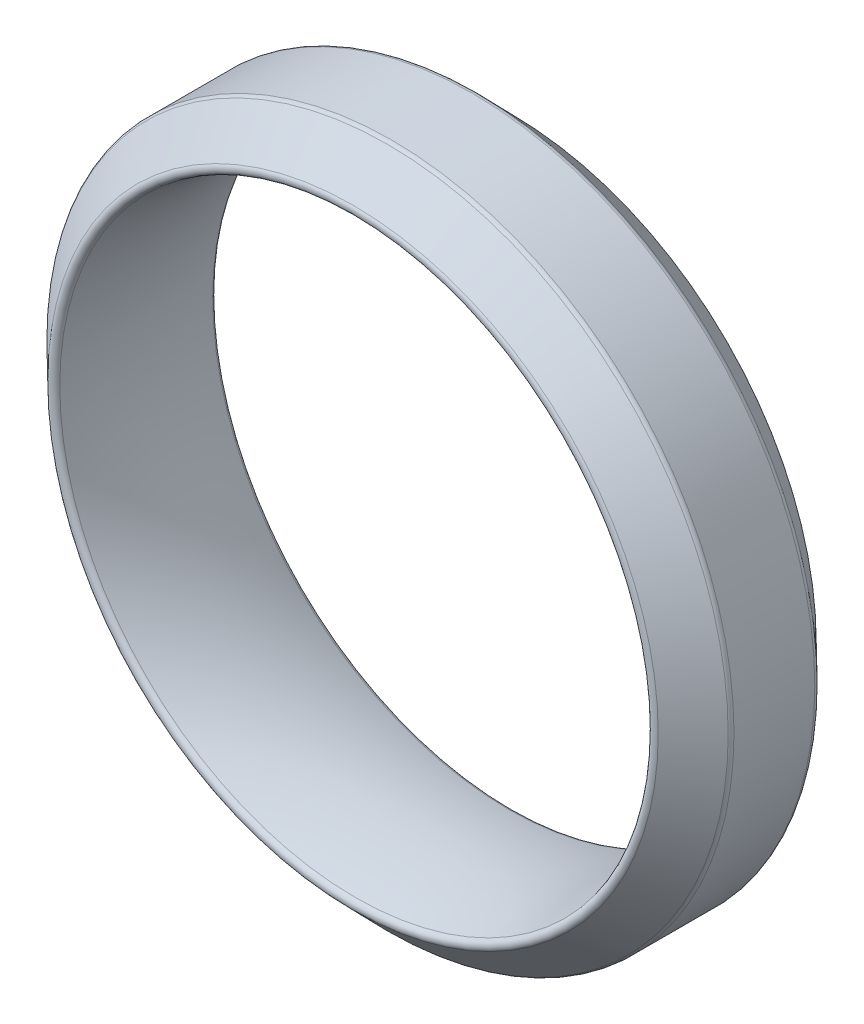
from build123d import *

# Parameters (mm, degrees)
FILLET1_R = 0.254
FILLET2_R = 0.254


with BuildPart() as part:
    # Sketch1 → Revolve1 (revolve)
    with BuildSketch(Plane(origin=(0, 0, 0), x_dir=(0, 0, -1), z_dir=(1, 0, 0)), mode=Mode.PRIVATE) as revolve1_sk:
        with BuildLine():
            Line((-3.81, 0.584972142), (-1.905, 2.54))
            Line((-1.905, 2.54), (1.905, 2.54))
            Line((1.905, 2.54), (3.81, 0.584972142))
            ThreePointArc((3.81, 0.584972142), (0, 0), (-3.81, 0.584972142))
        make_face()
    revolve(revolve1_sk.sketch.rotate(Axis((0, -12.7, 24.898515868), (0, 0, -1)), 90), axis=Axis((0, -12.7, 24.898515868), (0, 0, -1)))

    # Fillet1
    fillet1_edges = [part.edges().sort_by_distance(p)[0] for p in [
        (-13.284972142, -12.7, 3.81),
        (-13.284972142, -12.7, -3.81),
    ]]
    fillet(fillet1_edges, radius=FILLET1_R)

    # Fillet2
    fillet2_edges = [part.edges().sort_by_distance(p)[0] for p in [
        (-15.24, -12.7, 1.905),
        (-15.24, -12.7, -1.905),
    ]]
    fillet(fillet2_edges, radius=FILLET2_R)


solid = part.part
